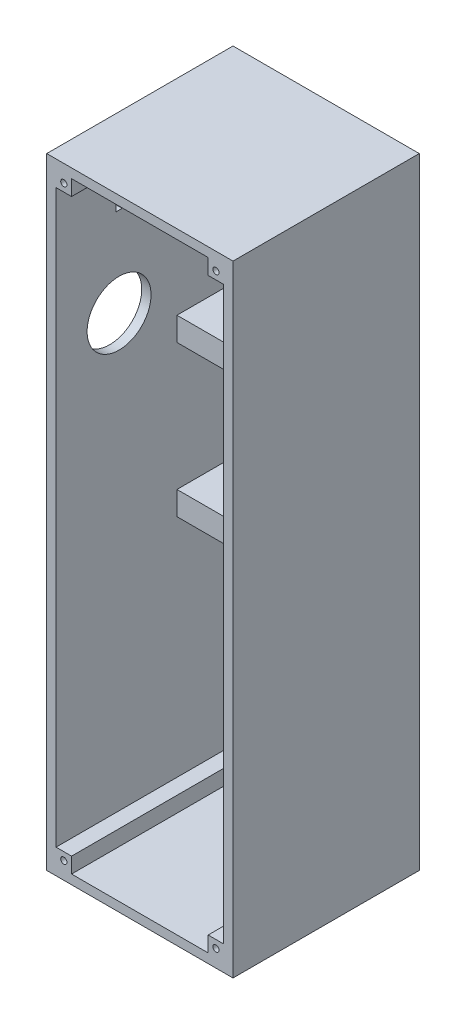
from build123d import *

# Parameters (mm, degrees)
SZKIC1_W                    = 60
SZKIC1_H                    = 60
DODANIE_WYCI_GNI_CIE1_DEPTH = 200
SKORUPA1_T                  = -3
SZKIC2_W                    = 5
SZKIC2_H                    = 5
SZKIC2_R                    = 1
DODANIE_WYCI_GNI_CIE5_DEPTH = 57
SZKIC3_W                    = 5
SZKIC3_H                    = 5
SZKIC3_R                    = 1
DODANIE_WYCI_GNI_CIE6_DEPTH = 57
SZKIC4_W                    = 5
SZKIC4_H                    = 5
SZKIC4_R                    = 1
DODANIE_WYCI_GNI_CIE7_DEPTH = 57
SZKIC5_W                    = 5
SZKIC5_H                    = 5
SZKIC5_R                    = 1
DODANIE_WYCI_GNI_CIE8_DEPTH = 57
SZKIC10_R                   = 10.3
WYTNIJ_WYCI_GNI_CIE3_DEPTH  = 3
SZKIC12_W                   = 45.55
SZKIC12_H                   = 7.6
DODANIE_WYCI_GNI_CIE9_DEPTH = 26.5
SZKIC13_R                   = 1.5
WYTNIJ_WYCI_GNI_CIE4_DEPTH  = 5
SZKIC15_R                   = 1.5
WYTNIJ_WYCI_GNI_CIE5_DEPTH  = 5
WYTNIJ_WYCI_GNI_CIE6_DEPTH  = 10
SZKIC17_W                   = 2
SZKIC17_H                   = 6
WYTNIJ_WYCI_GNI_CIE7_DEPTH  = 10


with BuildPart() as part:
    # Szkic1 → Dodanie-wyciągnięcie1 (new body)
    with BuildSketch(Plane(origin=(0, 0, 0), x_dir=(1, 0, 0), z_dir=(0, 1, 0))):
        with Locations((30, 30)):
            Rectangle(SZKIC1_W, SZKIC1_H)
    extrude(amount=DODANIE_WYCI_GNI_CIE1_DEPTH)

    # Skorupa1
    skorupa1_openings = [part.faces().sort_by_distance(p)[0] for p in [
        (30, 100, 0),
    ]]
    offset(amount=SKORUPA1_T, openings=skorupa1_openings, kind=Kind.INTERSECTION)

    # Szkic2 → Dodanie-wyciągnięcie5 (add)
    with BuildSketch(Plane.XY.offset(-57)):
        with Locations((5.5, 194.5)):
            Rectangle(SZKIC2_W, SZKIC2_H)
        with Locations(Location((5.5, 194.5, 0), (0, 0, 180))):
            Circle(SZKIC2_R, mode=Mode.SUBTRACT)
    extrude(amount=DODANIE_WYCI_GNI_CIE5_DEPTH)

    # Szkic3 → Dodanie-wyciągnięcie6 (add)
    with BuildSketch(Plane.XY.offset(-57)):
        with Locations((54.5, 194.5)):
            Rectangle(SZKIC3_W, SZKIC3_H)
        with Locations(Location((54.5, 194.5, 0), (0, 0, 180))):
            Circle(SZKIC3_R, mode=Mode.SUBTRACT)
    extrude(amount=DODANIE_WYCI_GNI_CIE6_DEPTH)

    # Szkic4 → Dodanie-wyciągnięcie7 (add)
    with BuildSketch(Plane.XY):
        with Locations((5.5, 5.5)):
            Rectangle(SZKIC4_W, SZKIC4_H)
        with Locations((5.5, 5.5)):
            Circle(SZKIC4_R, mode=Mode.SUBTRACT)
    extrude(amount=-DODANIE_WYCI_GNI_CIE7_DEPTH)

    # Szkic5 → Dodanie-wyciągnięcie8 (add)
    with BuildSketch(Plane.XY.offset(-57)):
        with Locations((54.5, 5.5)):
            Rectangle(SZKIC5_W, SZKIC5_H)
        with Locations(Location((54.5, 5.5, 0), (0, 0, 180))):
            Circle(SZKIC5_R, mode=Mode.SUBTRACT)
    extrude(amount=DODANIE_WYCI_GNI_CIE8_DEPTH)

    # Szkic10 → Wytnij-wyciągnięcie3 (cut)
    with BuildSketch(Plane.ZY):
        with Locations((-20.3, 146.82)):
            Circle(SZKIC10_R)
    extrude(amount=-WYTNIJ_WYCI_GNI_CIE3_DEPTH, mode=Mode.SUBTRACT)

    # Szkic12 → Dodanie-wyciągnięcie9 (add)
    with BuildSketch(Plane.ZY.offset(-57)):
        with Locations((-34.225, 160.62)):
            Rectangle(SZKIC12_W, SZKIC12_H)
        with Locations((-34.225, 112.02)):
            Rectangle(SZKIC12_W, SZKIC12_H)
    extrude(amount=DODANIE_WYCI_GNI_CIE9_DEPTH)

    # Szkic13 → Wytnij-wyciągnięcie4 (cut)
    with BuildSketch(Plane.ZY.offset(-30.5)):
        with Locations((-15.45, 162.42)):
            Circle(SZKIC13_R)
        with Locations((-25.1, 162.42)):
            Circle(SZKIC13_R)
    extrude(amount=-WYTNIJ_WYCI_GNI_CIE4_DEPTH, mode=Mode.SUBTRACT)

    # Szkic15 → Wytnij-wyciągnięcie5 (cut)
    with BuildSketch(Plane.ZY.offset(-30.5)):
        with Locations((-15.45, 111.22)):
            Circle(SZKIC15_R)
        with Locations((-25.1, 111.22)):
            Circle(SZKIC15_R)
    extrude(amount=-WYTNIJ_WYCI_GNI_CIE5_DEPTH, mode=Mode.SUBTRACT)

    # Szkic16 → Wytnij-wyciągnięcie6 (cut)
    with BuildSketch(Plane(origin=(0, 164.42, 0), x_dir=(1, 0, 0), z_dir=(0, 1, 0))):
        Polygon((57, 11.45), (57, 26.45), (48, 11.45), align=None)
    extrude(amount=-WYTNIJ_WYCI_GNI_CIE6_DEPTH, mode=Mode.SUBTRACT)

    # Szkic17 → Wytnij-wyciągnięcie7 (cut)
    with BuildSketch(Plane.ZY):
        with Locations((-20.3, 178.56)):
            Rectangle(SZKIC17_W, SZKIC17_H)
    extrude(amount=-WYTNIJ_WYCI_GNI_CIE7_DEPTH, mode=Mode.SUBTRACT)


solid = part.part
